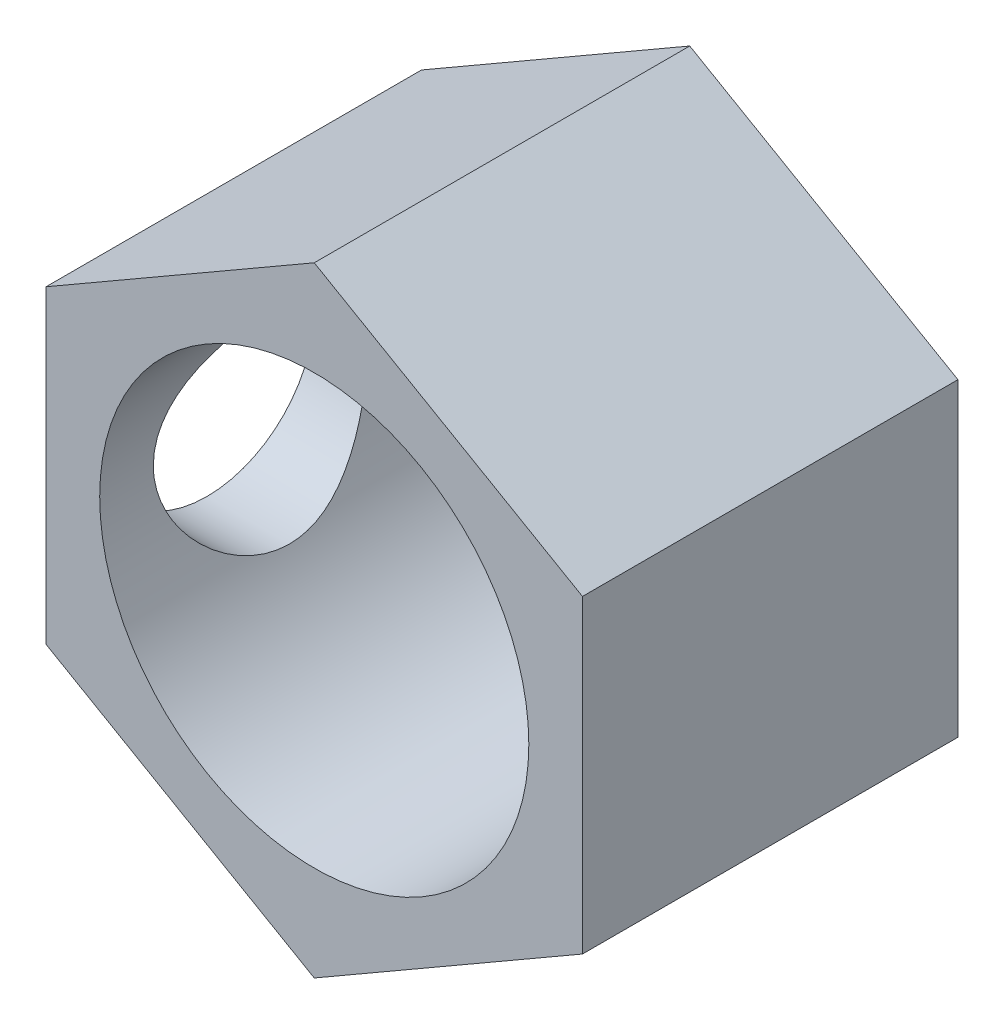
from build123d import *

# Parameters (mm, degrees)
BOSS_EXTRUDE1_DEPTH = 6
SKETCH3_R           = 2
CUT_EXTRUDE1_DEPTH  = 2.5
CUT_EXTRUDE5_REACH  = 11.713
SKETCH5_R           = 2
SKETCH6_R           = 2
BOSS_EXTRUDE2_DEPTH = 1
CUT_EXTRUDE6_REACH  = 12.36
SKETCH7_R           = 4


with BuildPart() as part:
    # Sketch2 → Boss-Extrude1 (new body)
    with BuildSketch(Plane.XY):
        Polygon((0, -5.773502692), (5, -2.886751346), (5, 2.886751346), (0, 5.773502692), (-5, 2.886751346), (-5, -2.886751346), align=None)
    extrude(amount=BOSS_EXTRUDE1_DEPTH)

    # Sketch3 → Cut-Extrude1 (cut)
    with BuildSketch(Plane.ZY.offset(5)):
        with Locations(Location((3, 0, 0), (0, 0, 270))):
            Circle(SKETCH3_R)
    extrude(amount=-CUT_EXTRUDE1_DEPTH, mode=Mode.SUBTRACT)

    # Sketch5 → Cut-Extrude5 (cut, up to next)
    with BuildSketch(Plane.XY.offset(6), mode=Mode.PRIVATE) as cut_extrude5_sk1:
        Circle(SKETCH5_R)
    cut_extrude5_tool1 = extrude(cut_extrude5_sk1.sketch, amount=-CUT_EXTRUDE5_REACH, mode=Mode.PRIVATE) & part.part
    add(cut_extrude5_tool1.solids().sort_by_distance((0, 0, 6))[0], mode=Mode.SUBTRACT)

    # Sketch6 → Boss-Extrude2 (add)
    with BuildSketch(Plane(origin=(0, 0, 0), x_dir=(-1, 0, 0), z_dir=(0, 0, -1))):
        Polygon((0, 5.773502692), (-5, 2.886751346), (-5, -2.886751346), (0, -5.773502692), (5, -2.886751346), (5, 2.886751346), align=None)
        with Locations(Location((0, 0, 0), (0, 0, 180))):
            Circle(SKETCH6_R, mode=Mode.SUBTRACT)
    extrude(amount=BOSS_EXTRUDE2_DEPTH)

    # Sketch7 → Cut-Extrude6 (cut, up to next)
    with BuildSketch(Plane(origin=(0, 0, -1), x_dir=(-1, 0, 0), z_dir=(0, 0, -1)), mode=Mode.PRIVATE) as cut_extrude6_sk1:
        Circle(SKETCH7_R)
    cut_extrude6_tool1 = extrude(cut_extrude6_sk1.sketch, amount=-CUT_EXTRUDE6_REACH, mode=Mode.PRIVATE) & part.part
    add(cut_extrude6_tool1.solids().sort_by_distance((0, 0, -1))[0], mode=Mode.SUBTRACT)


solid = part.part
